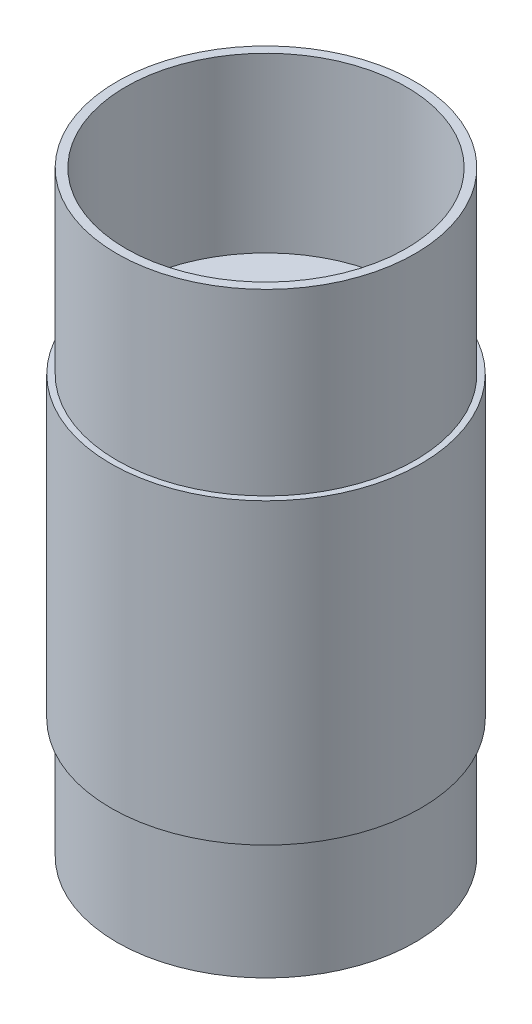
from build123d import *

# Parameters (mm, degrees)
ESBO_O1_R                = 25
ESBO_O1_R_2              = 23.5
RESSALTO_EXTRUS_O1_DEPTH = 20
ESBO_O2_R                = 26
ESBO_O2_R_2              = 25
RESSALTO_EXTRUS_O2_DEPTH = 50
ESBO_O3_R                = 25
ESBO_O3_R_2              = 23.5
RESSALTO_EXTRUS_O3_DEPTH = 30
ESBO_O18_R               = 24
RESSALTO_EXTRUS_O4_DEPTH = 1


with BuildPart() as part:
    # Esboço1 → Ressalto-extrusão1 (new body)
    with BuildSketch(Plane(origin=(0, 0, 0), x_dir=(1, 0, 0), z_dir=(0, 1, 0))):
        with Locations(Location((0, 0, 0), (0, 0, 270))):
            Circle(ESBO_O1_R)
        with Locations(Location((0, 0, 0), (0, 0, 270))):
            Circle(ESBO_O1_R_2, mode=Mode.SUBTRACT)
    extrude(amount=RESSALTO_EXTRUS_O1_DEPTH)


with BuildPart() as body_2:
    # Esboço2 → Ressalto-extrusão2 (new body)
    with BuildSketch(Plane(origin=(0, 20, 0), x_dir=(1, 0, 0), z_dir=(0, 1, 0))):
        with Locations(Location((0, 0, 0), (0, 0, 270))):
            Circle(ESBO_O2_R)
        with Locations(Location((0, 0, 0), (0, 0, 270))):
            Circle(ESBO_O2_R_2, mode=Mode.SUBTRACT)
    extrude(amount=RESSALTO_EXTRUS_O2_DEPTH)


with BuildPart() as body_3:
    # Esboço3 → Ressalto-extrusão3 (new body)
    with BuildSketch(Plane(origin=(0, 70, 0), x_dir=(1, 0, 0), z_dir=(0, 1, 0))):
        with Locations(Location((0, 0, 0), (0, 0, 270))):
            Circle(ESBO_O3_R)
        with Locations(Location((0, 0, 0), (0, 0, 270))):
            Circle(ESBO_O3_R_2, mode=Mode.SUBTRACT)
    extrude(amount=RESSALTO_EXTRUS_O3_DEPTH)

    # Esboço18 → Ressalto-extrusão4 (add)
    with BuildSketch(Plane(origin=(0, 70, 0), x_dir=(1, 0, 0), z_dir=(0, 1, 0))):
        Circle(ESBO_O18_R)
    extrude(amount=RESSALTO_EXTRUS_O4_DEPTH)


solid = Compound([part.part, body_2.part, body_3.part])
